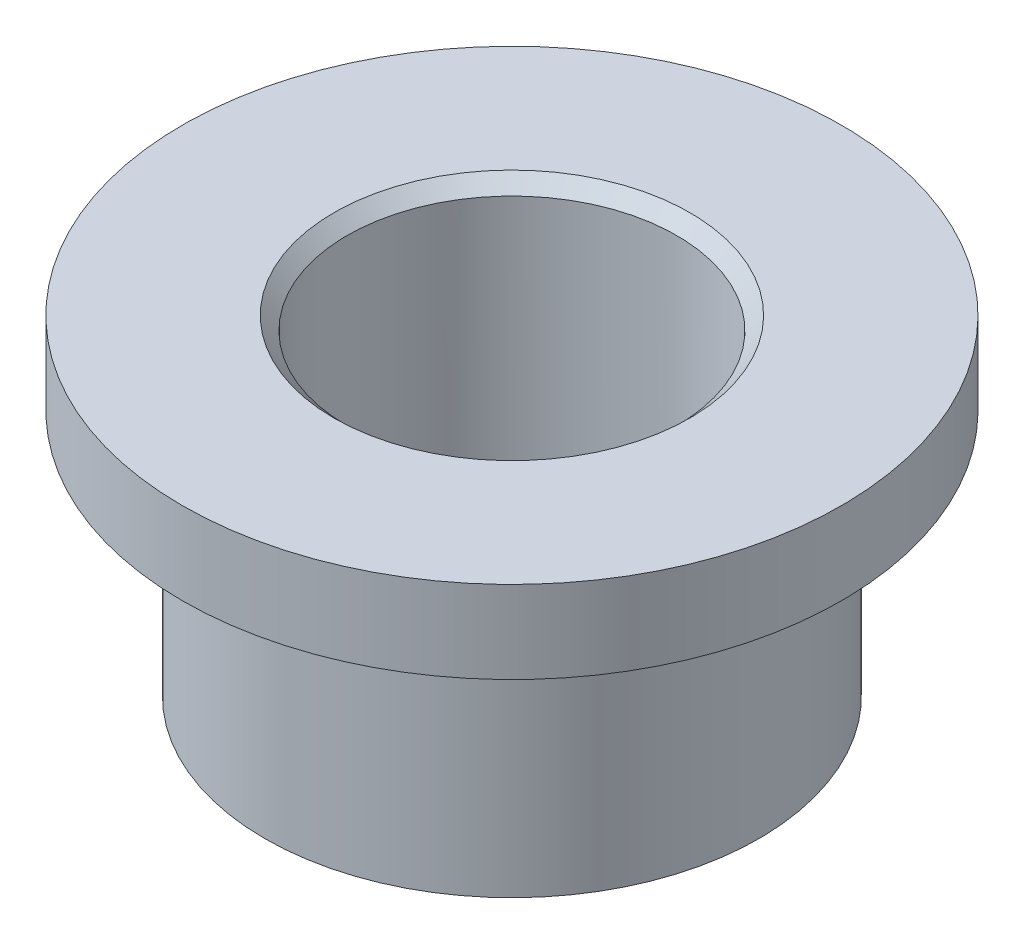
from build123d import *

# Parameters (mm, degrees)
CHAMFER1_SIZE = 0.254


with BuildPart() as part:
    # Sketch1 → Revolve1 (revolve)
    with BuildSketch(Plane.XY, mode=Mode.PRIVATE) as revolve1_sk:
        Polygon((-3.175, 3.175), (-6.35, 3.175), (-6.35, 1.5875), (-4.7625, 1.5875), (-4.7625, -3.175), (-3.175, -3.175), align=None)
    revolve(revolve1_sk.sketch.rotate(Axis((0, 6.35, 0), (0, -1, 0)), 270), axis=Axis((0, 6.35, 0), (0, -1, 0)))

    # Chamfer1
    chamfer1_edges = [part.edges().sort_by_distance(p)[0] for p in [
        (0, -3.175, -3.175),
        (0, 3.175, -3.175),
    ]]
    chamfer(chamfer1_edges, length=CHAMFER1_SIZE)


solid = part.part
